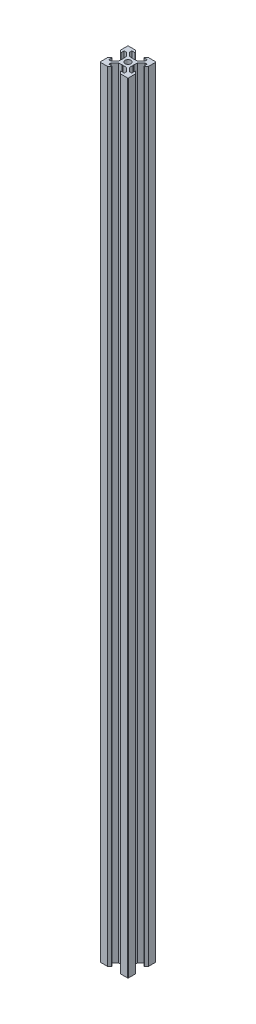
from build123d import *

# Parameters (mm, degrees)
BOSS_EXTRUDE1_DEPTH = 555


with BuildPart() as part:
    # Sketch1 → Boss-Extrude1 (new body)
    with BuildSketch(Plane(origin=(0, 0, 0), x_dir=(1, 0, 0), z_dir=(0, 1, 0))):
        with BuildLine():
            Line((20, 5.42), (20, 0.5))
            ThreePointArc((20, 0.5), (19.853553391, 0.146446609), (19.5, 0))
            Line((19.5, 0), (14.58, 0))
            Line((14.58, 0), (13.13, 1.549339828))
            Line((13.13, 1.549339828), (13.13, 1.799339828))
            Line((13.13, 1.799339828), (15.5, 1.799339828))
            Line((15.5, 1.799339828), (15.5, 3.439339828))
            Line((15.5, 3.439339828), (12.84, 6.099339828))
            Line((12.84, 6.099339828), (10.25, 6.099339828))
            Line((10.25, 6.099339828), (10, 6.349339828))
            Line((10, 6.349339828), (9.75, 6.099339828))
            Line((9.75, 6.099339828), (7.16, 6.099339828))
            Line((7.16, 6.099339828), (4.5, 3.439339828))
            Line((4.5, 3.439339828), (4.5, 1.799339828))
            Line((4.5, 1.799339828), (6.875, 1.799339828))
            Line((6.875, 1.799339828), (6.875, 1.549339828))
            Line((6.875, 1.549339828), (5.42, 0))
            Line((5.42, 0), (0.5, 0))
            ThreePointArc((0.5, 0), (0.146446609, 0.146446609), (0, 0.5))
            Line((0, 0.5), (0, 5.42))
            Line((0, 5.42), (1.549339828, 6.87))
            Line((1.549339828, 6.87), (1.799339828, 6.87))
            Line((1.799339828, 6.87), (1.799339828, 4.5))
            Line((1.799339828, 4.5), (3.439339828, 4.5))
            Line((3.439339828, 4.5), (6.099339828, 7.16))
            Line((6.099339828, 7.16), (6.099339828, 9.75))
            Line((6.099339828, 9.75), (6.349339828, 10))
            Line((6.349339828, 10), (6.099339828, 10.25))
            Line((6.099339828, 10.25), (6.099339828, 12.84))
            Line((6.099339828, 12.84), (3.439339828, 15.5))
            Line((3.439339828, 15.5), (1.799339828, 15.5))
            Line((1.799339828, 15.5), (1.799339828, 13.125))
            Line((1.799339828, 13.125), (1.549339828, 13.125))
            Line((1.549339828, 13.125), (0, 14.58))
            Line((0, 14.58), (0, 19.5))
            ThreePointArc((0, 19.5), (0.146446609, 19.853553391), (0.5, 20))
            Line((0.5, 20), (5.42, 20))
            Line((5.42, 20), (6.87, 18.450660172))
            Line((6.87, 18.450660172), (6.87, 18.200660172))
            Line((6.87, 18.200660172), (4.5, 18.200660172))
            Line((4.5, 18.200660172), (4.5, 16.560660172))
            Line((4.5, 16.560660172), (7.16, 13.900660172))
            Line((7.16, 13.900660172), (9.75, 13.900660172))
            Line((9.75, 13.900660172), (10, 13.650660172))
            Line((10, 13.650660172), (10.25, 13.900660172))
            Line((10.25, 13.900660172), (12.84, 13.900660172))
            Line((12.84, 13.900660172), (15.5, 16.560660172))
            Line((15.5, 16.560660172), (15.5, 18.200660172))
            Line((15.5, 18.200660172), (13.125, 18.200660172))
            Line((13.125, 18.200660172), (13.125, 18.450660172))
            Line((13.125, 18.450660172), (14.58, 20))
            Line((14.58, 20), (19.5, 20))
            ThreePointArc((19.5, 20), (19.853553391, 19.853553391), (20, 19.5))
            Line((20, 19.5), (20, 14.58))
            Line((20, 14.58), (18.450660172, 13.13))
            Line((18.450660172, 13.13), (18.200660172, 13.13))
            Line((18.200660172, 13.13), (18.200660172, 15.5))
            Line((18.200660172, 15.5), (16.560660172, 15.5))
            Line((16.560660172, 15.5), (13.900660172, 12.84))
            Line((13.900660172, 12.84), (13.900660172, 10.25))
            Line((13.900660172, 10.25), (13.650660172, 10))
            Line((13.650660172, 10), (13.900660172, 9.75))
            Line((13.900660172, 9.75), (13.900660172, 7.16))
            Line((13.900660172, 7.16), (16.560660172, 4.5))
            Line((16.560660172, 4.5), (18.200660172, 4.5))
            Line((18.200660172, 4.5), (18.200660172, 6.875))
            Line((18.200660172, 6.875), (18.450660172, 6.875))
            Line((18.450660172, 6.875), (20, 5.42))
        make_face()
        with BuildLine():
            ThreePointArc((12.1, 10), (11.48492424, 11.48492424), (10, 12.1))
            ThreePointArc((10, 12.1), (8.51507576, 11.48492424), (7.9, 10))
            ThreePointArc((7.9, 10), (8.51507576, 8.51507576), (10, 7.9))
            ThreePointArc((10, 7.9), (11.48492424, 8.51507576), (12.1, 10))
        make_face(mode=Mode.SUBTRACT)
    extrude(amount=BOSS_EXTRUDE1_DEPTH)


solid = part.part
